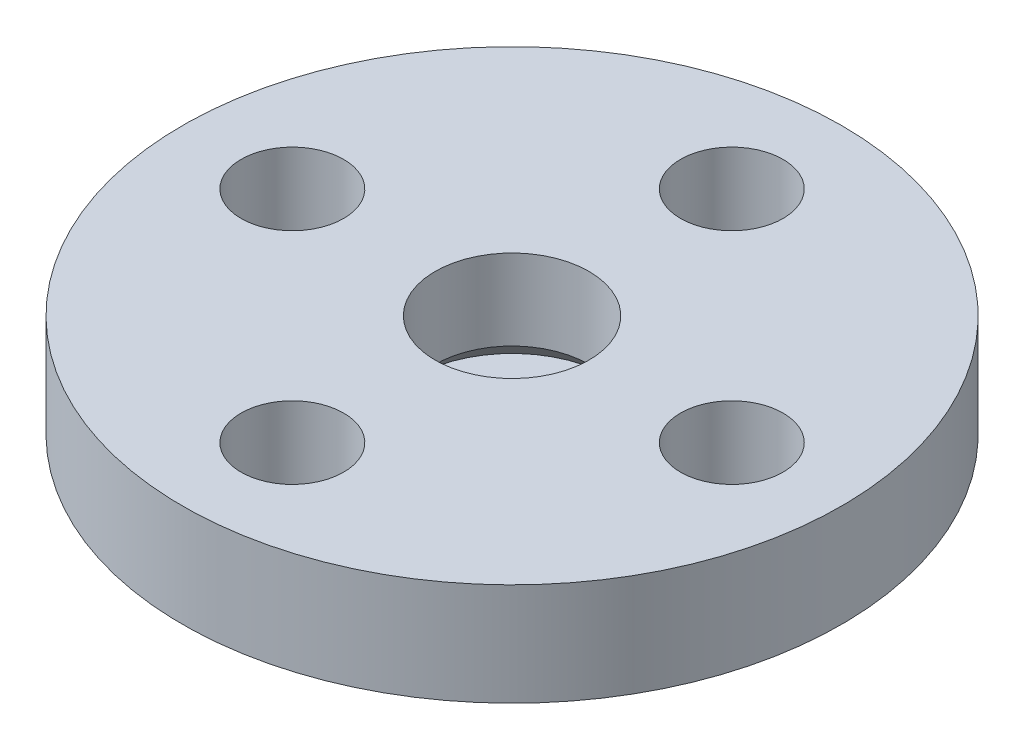
from build123d import *

# Parameters (mm, degrees)
SKETCH_3_R               = 7
CUT_EXTRUDE_1_DEPTH      = 14
PATTERN_CIRCULAR_1_COUNT = 4


with BuildPart() as part:
    # 草图2 → 旋转1 (revolve)
    with BuildSketch(Plane(origin=(0, 0, 0), x_dir=(0, 0, -1), z_dir=(1, 0, 0))):
        Polygon((12, -12), (20, -12), (20, -7.5), (20, 0), (45, 0), (45, 14), (10.5, 14), (10.5, 3), (13.5, 0), (9, 0), (9, -7.5), (12, -7.5), align=None)
    revolve(axis=Axis((0, 0, 0), (0, 1, 0)))

    # 草图3 → 切除-拉伸1 (cut)
    with BuildSketch(Plane(origin=(0, 0, 0), x_dir=(1, 0, 0), z_dir=(0, 1, 0))):
        with Locations(Location((0, 30, 0), (0, 0, 270))):
            Circle(SKETCH_3_R)
    cut_extrude_1 = extrude(amount=CUT_EXTRUDE_1_DEPTH, mode=Mode.SUBTRACT)

    # 阵列(圆周)1: 切除-拉伸1 ×4 about axis
    pattern_circular_1_axis = Axis((0, 0, 0), (0, 1, 0))
    for i in range(1, PATTERN_CIRCULAR_1_COUNT):
        add(cut_extrude_1.rotate(pattern_circular_1_axis, i * 360 / PATTERN_CIRCULAR_1_COUNT), mode=Mode.SUBTRACT)


solid = part.part
